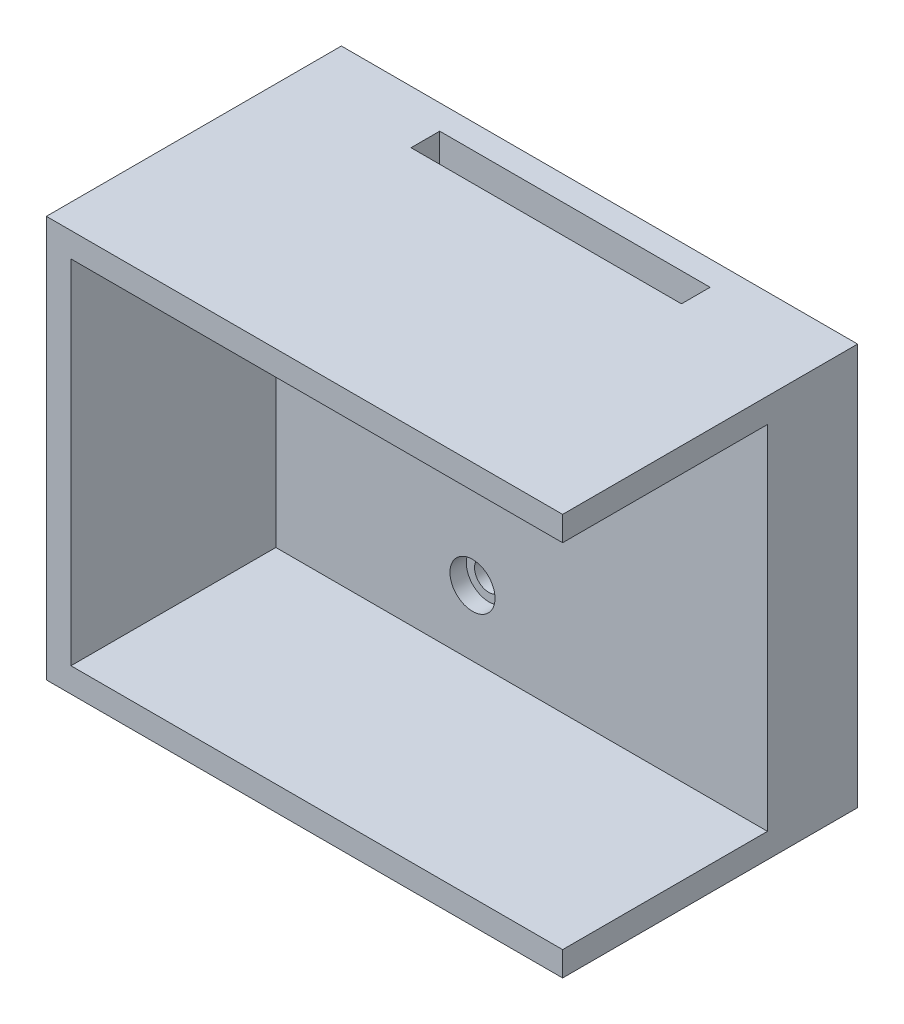
from build123d import *

# Parameters (mm, degrees)
EXTRUDE_1_DEPTH     = 25
SKETCH_2_W          = 53
SKETCH_2_H          = 49
EXTRUDE_2_DEPTH     = 11
SKETCH_4_R          = 2.75
CUT_EXTRUDE_1_DEPTH = 2
SKETCH_5_R          = 1.75
CUT_EXTRUDE_2_DEPTH = 76.193084788
SKETCH_8_W          = 33
SKETCH_8_H          = 3.5
CUT_EXTRUDE_3_DEPTH = 77.387171698
EXTRUDE_3_DEPTH     = 10


with BuildPart() as part:
    # 草图1 → 凸台-拉伸1 (new body)
    with BuildSketch(Plane.XY):
        Polygon((0, 43), (0, 46), (-53, 46), (-53, -3), (0, -3), (0, 0), (-50, 0), (-50, 43), align=None)
    extrude(amount=EXTRUDE_1_DEPTH)

    # 草图2 → 凸台-拉伸2 (add)
    with BuildSketch(Plane(origin=(0, 0, 0), x_dir=(-1, 0, 0), z_dir=(0, 0, -1))):
        with Locations((26.5, 21.5)):
            Rectangle(SKETCH_2_W, SKETCH_2_H)
    extrude(amount=EXTRUDE_2_DEPTH)

    # 草图4 → 切除-拉伸1 (cut)
    with BuildSketch(Plane.XY):
        with Locations((-26, 35)):
            Circle(SKETCH_4_R)
        with Locations((-26, 8)):
            Circle(SKETCH_4_R)
    extrude(amount=-CUT_EXTRUDE_1_DEPTH, mode=Mode.SUBTRACT)

    # 草图5 → 切除-拉伸2 (cut, through all)
    with BuildSketch(Plane.XY.offset(-2)):
        with Locations((-26, 8)):
            Circle(SKETCH_5_R)
        with Locations((-26, 35)):
            Circle(SKETCH_5_R)
    extrude(amount=-CUT_EXTRUDE_2_DEPTH, mode=Mode.SUBTRACT)

    # 草图8 → 切除-拉伸3 (cut, through all)
    with BuildSketch(Plane.XZ.offset(3)):
        with Locations((-21.5, -6.25)):
            Rectangle(SKETCH_8_W, SKETCH_8_H)
    extrude(amount=-CUT_EXTRUDE_3_DEPTH, mode=Mode.SUBTRACT)

    # 草图9 → 凸台-拉伸3 (add)
    with BuildSketch(Plane(origin=(0, 0, 0), x_dir=(0, 0, -1), z_dir=(1, 0, 0))):
        Polygon((-25, 43), (0, 43), (0, 0), (-25, 0), (-25, -3), (11, -3), (11, 46), (-25, 46), align=None)
    extrude(amount=EXTRUDE_3_DEPTH)


solid = part.part
